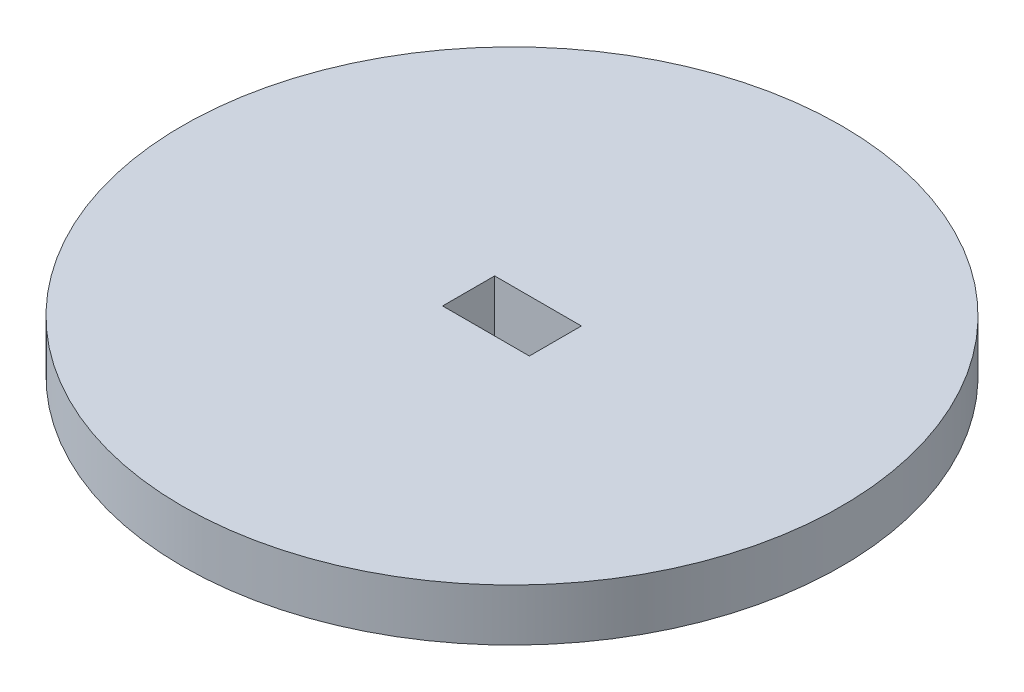
from build123d import *

# Parameters (mm, degrees)
ESBO_O1_R                = 38
RESSALTO_EXTRUS_O1_DEPTH = 6
ESBO_O5_W                = 10
ESBO_O5_H                = 6
CORTE_EXTRUS_O1_DEPTH    = 6


with BuildPart() as part:
    # Esboço1 → Ressalto-extrusão1 (new body)
    with BuildSketch(Plane(origin=(0, 0, 0), x_dir=(1, 0, 0), z_dir=(0, 1, 0))):
        with Locations(Location((0, 0, 0), (0, 0, 270))):
            Circle(ESBO_O1_R)
    extrude(amount=RESSALTO_EXTRUS_O1_DEPTH)

    # Esboço5 → Corte-extrusão1 (cut)
    with BuildSketch(Plane(origin=(0, 6, 0), x_dir=(1, 0, 0), z_dir=(0, 1, 0))):
        Rectangle(ESBO_O5_W, ESBO_O5_H)
    extrude(amount=-CORTE_EXTRUS_O1_DEPTH, mode=Mode.SUBTRACT)


solid = part.part
